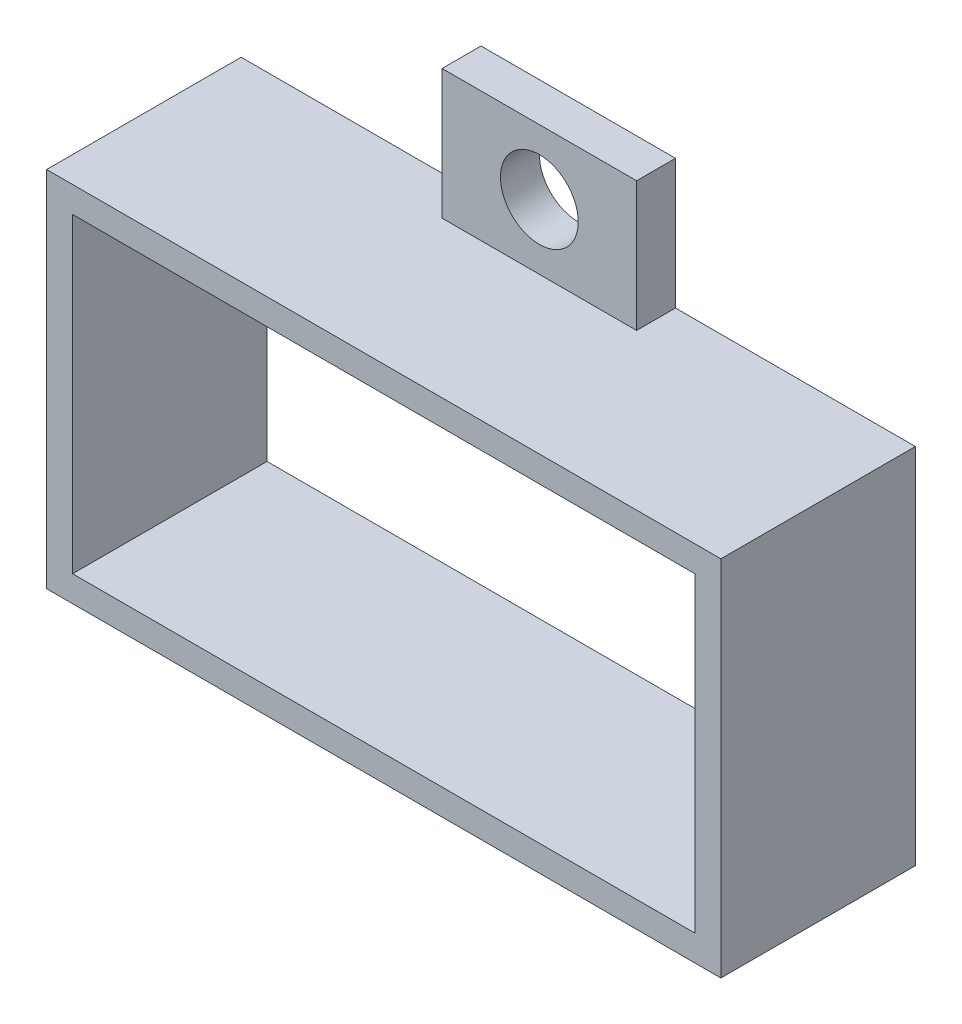
from build123d import *

# Parameters (mm, degrees)
SKETCH_1_W          = 52
SKETCH_1_H          = 28
SKETCH_1_W_2        = 48
SKETCH_1_H_2        = 24
EXTRUDE_1_DEPTH     = 15
SKETCH_2_W          = 15
SKETCH_2_H          = 3
EXTRUDE_2_DEPTH     = 10
SKETCH_3_R          = 3
CUT_EXTRUDE_1_DEPTH = 10


with BuildPart() as part:
    # 草圖1 → 填料-伸長1 (new body)
    with BuildSketch(Plane.XY):
        Rectangle(SKETCH_1_W, SKETCH_1_H)
        Rectangle(SKETCH_1_W_2, SKETCH_1_H_2, mode=Mode.SUBTRACT)
    extrude(amount=EXTRUDE_1_DEPTH)

    # 草圖2 → 填料-伸長2 (add)
    with BuildSketch(Plane(origin=(0, 14, 0), x_dir=(1, 0, 0), z_dir=(0, 1, 0))):
        with Locations((0, -1.5)):
            Rectangle(SKETCH_2_W, SKETCH_2_H)
    extrude_2 = extrude(amount=EXTRUDE_2_DEPTH)

    # 草圖3 → 除料-伸長1 (cut)
    with BuildSketch(Plane.XY.offset(3)):
        with Locations((0, 19)):
            Circle(SKETCH_3_R)
    cut_extrude_1 = extrude(amount=-CUT_EXTRUDE_1_DEPTH, mode=Mode.SUBTRACT)

    # 鏡射1: 填料-伸長2, 除料-伸長1 across plane
    add(extrude_2.mirror(Plane.ZX))
    add(cut_extrude_1.mirror(Plane.ZX), mode=Mode.SUBTRACT)


solid = part.part
